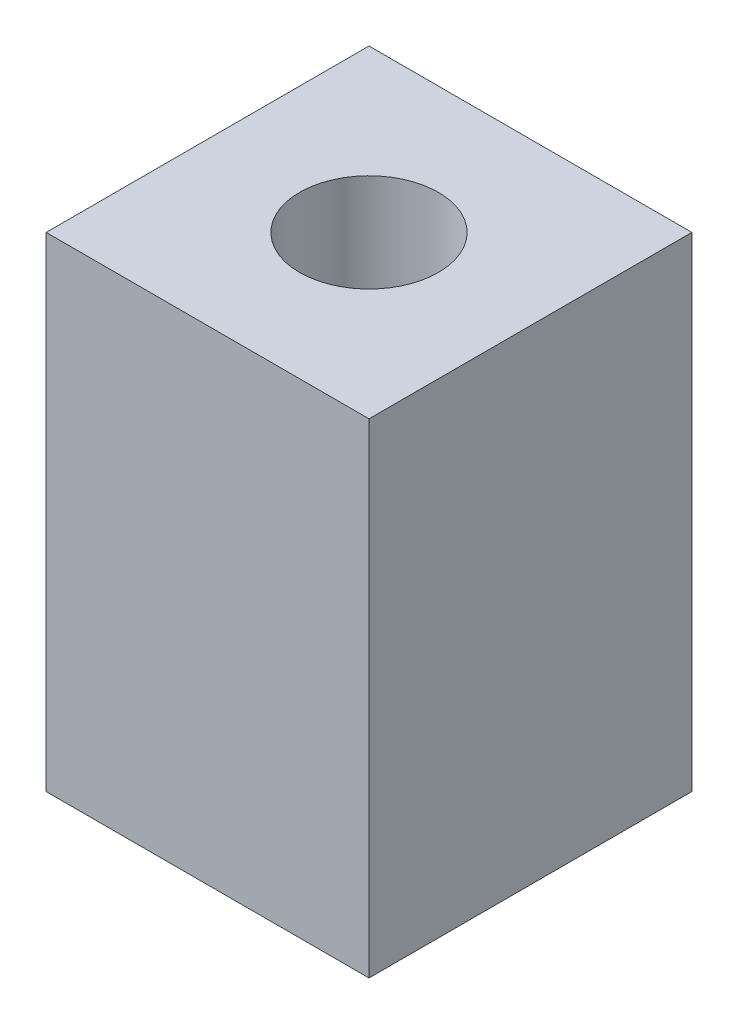
from build123d import *

# Parameters (mm, degrees)
SKETCH1_W           = 20
SKETCH1_H           = 20
BOSS_EXTRUDE1_DEPTH = 30
SKETCH2_R           = 4.3
CUT_EXTRUDE1_DEPTH  = 38.416573868


with BuildPart() as part:
    # Sketch1 → Boss-Extrude1 (new body)
    with BuildSketch(Plane(origin=(0, 0, 0), x_dir=(1, 0, 0), z_dir=(0, 1, 0))):
        with Locations((-10, 0)):
            Rectangle(SKETCH1_W, SKETCH1_H)
    extrude(amount=BOSS_EXTRUDE1_DEPTH)

    # Sketch2 → Cut-Extrude1 (cut, through all)
    with BuildSketch(Plane(origin=(0, 30, 0), x_dir=(1, 0, 0), z_dir=(0, 1, 0))):
        with Locations(Location((-10, 0, 0), (0, 0, 270))):
            Circle(SKETCH2_R)
    extrude(amount=-CUT_EXTRUDE1_DEPTH, mode=Mode.SUBTRACT)


solid = part.part
